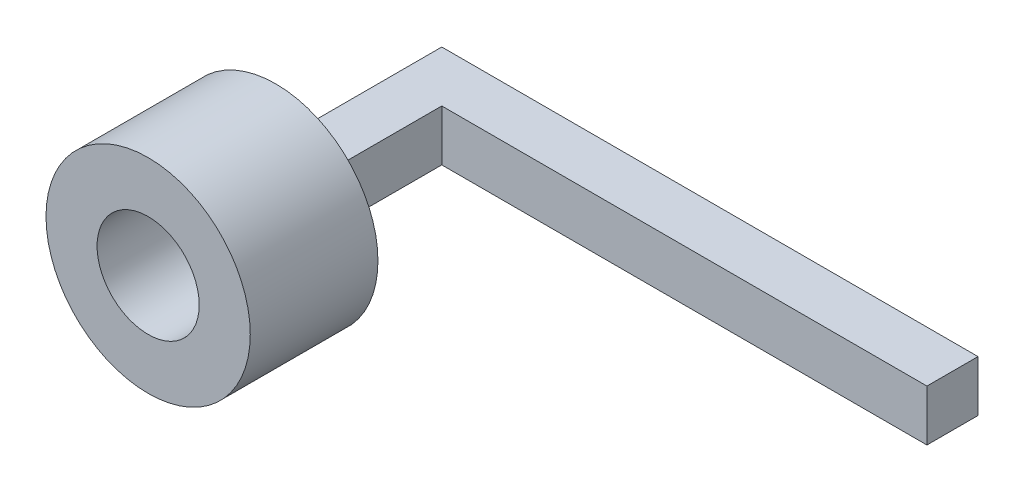
from build123d import *

# Parameters (mm, degrees)
SKETCH1_R           = 2
BOSS_EXTRUDE1_DEPTH = 2.5
SHELL1_T            = -1
SKETCH2_W           = 1
SKETCH2_H           = 1
BOSS_EXTRUDE2_DEPTH = 3.75
SKETCH3_W           = 1
SKETCH3_H           = 1
BOSS_EXTRUDE3_DEPTH = 9.5


with BuildPart() as part:
    # Sketch1 → Boss-Extrude1 (new body)
    with BuildSketch(Plane.XY):
        Circle(SKETCH1_R)
    extrude(amount=BOSS_EXTRUDE1_DEPTH)

    # Shell1
    shell1_openings = [part.faces().sort_by_distance(p)[0] for p in [
        (0, 0, 2.5),
    ]]
    offset(amount=SHELL1_T, openings=shell1_openings, kind=Kind.INTERSECTION)

    # Sketch2 → Boss-Extrude2 (add)
    with BuildSketch(Plane(origin=(0, 0, 0), x_dir=(-1, 0, 0), z_dir=(0, 0, -1))):
        Rectangle(SKETCH2_W, SKETCH2_H)
    extrude(amount=BOSS_EXTRUDE2_DEPTH)

    # Sketch3 → Boss-Extrude3 (add)
    with BuildSketch(Plane(origin=(0.5, 0, 0), x_dir=(0, 0, -1), z_dir=(1, 0, 0))):
        with Locations((3.25, 0)):
            Rectangle(SKETCH3_W, SKETCH3_H)
    extrude(amount=BOSS_EXTRUDE3_DEPTH)


solid = part.part
